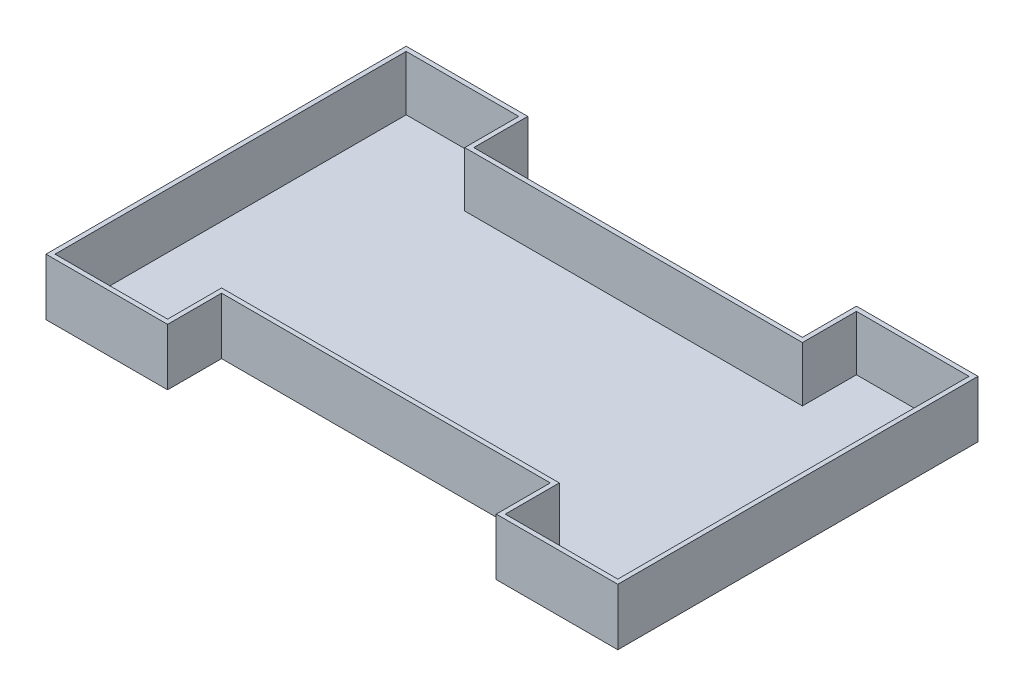
from build123d import *

# Parameters (mm, degrees)
SKETCH1_W           = 806.45
SKETCH1_H           = 508
BOSS_EXTRUDE1_DEPTH = 2.54
SKETCH2_W           = 463.55
SKETCH2_H           = 76.2
CUT_EXTRUDE1_DEPTH  = 2.54
BOSS_EXTRUDE2_DEPTH = 77.47


with BuildPart() as part:
    # Sketch1 → Boss-Extrude1 (new body)
    with BuildSketch(Plane(origin=(0, 0, 0), x_dir=(1, 0, 0), z_dir=(0, 1, 0))):
        Rectangle(SKETCH1_W, SKETCH1_H)
    extrude(amount=BOSS_EXTRUDE1_DEPTH)

    # Sketch2 → Cut-Extrude1 (cut)
    with BuildSketch(Plane(origin=(0, 2.54, 0), x_dir=(1, 0, 0), z_dir=(0, 1, 0))):
        with Locations((0, -215.9)):
            Rectangle(SKETCH2_W, SKETCH2_H)
        with Locations((0, 215.9)):
            Rectangle(SKETCH2_W, SKETCH2_H)
    extrude(amount=-CUT_EXTRUDE1_DEPTH, mode=Mode.SUBTRACT)

    # Sketch3 → Boss-Extrude2 (add)
    with BuildSketch(Plane(origin=(0, 2.54, 0), x_dir=(1, 0, 0), z_dir=(0, 1, 0))):
        Polygon((-231.775, -254), (-231.775, -177.8), (231.775, -177.8), (231.775, -254), (403.225, -254), (403.225, 254), (231.775, 254), (231.775, 177.8), (-231.775, 177.8), (-231.775, 254), (-403.225, 254), (-403.225, -254), align=None)
        Polygon((238.125, 171.45), (-238.125, 171.45), (-238.125, 247.65), (-396.875, 247.65), (-396.875, -247.65), (-238.125, -247.65), (-238.125, -171.45), (238.125, -171.45), (238.125, -247.65), (396.875, -247.65), (396.875, 247.65), (238.125, 247.65), align=None, mode=Mode.SUBTRACT)
    extrude(amount=BOSS_EXTRUDE2_DEPTH)


solid = part.part
